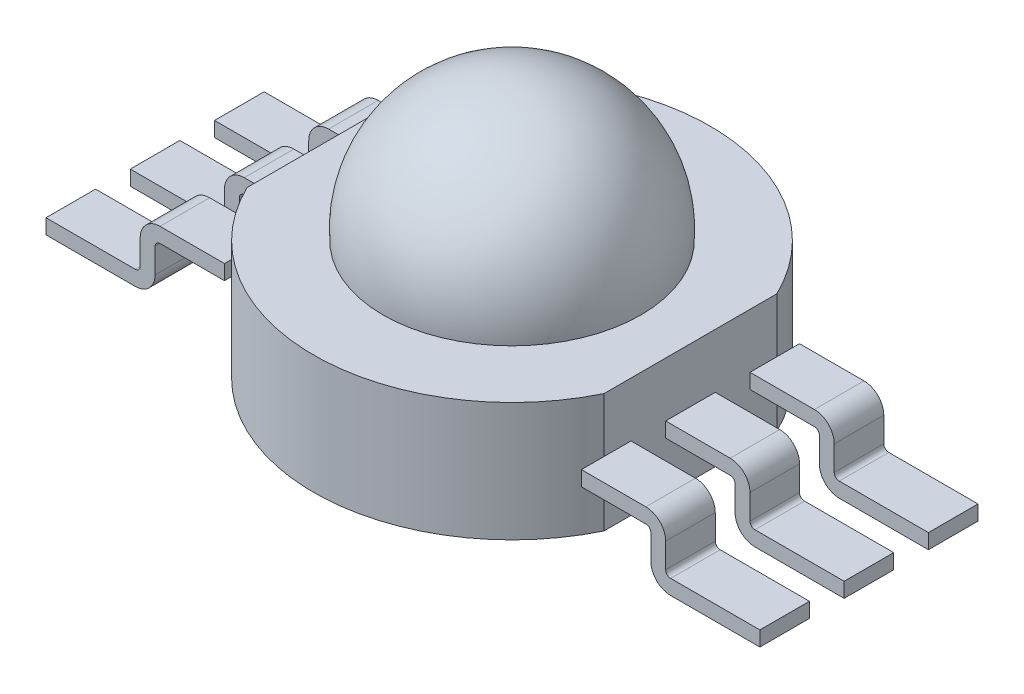
from build123d import *

# Parameters (mm, degrees)
LED_BASE_BOSS_EXTRUDE1_DEPTH       = 2.4
PIN_RIGHT_BOSS_EXTRUDE2_DEPTH      = 2.2
PIN_RIGHT_SPACE_CUT_EXTRUDE1_REACH = 11.113
SKETCH5_W                          = 3.6
SKETCH5_H                          = 0.7
SKETCH6_R                          = 2.95
HEATSINK_BOSS_EXTRUDE3_DEPTH       = 0.1


with BuildPart() as part:
    # Sketch1 → LED Base Boss-Extrude1 (new body)
    with BuildSketch(Plane(origin=(0, 0, 0), x_dir=(1, 0, 0), z_dir=(0, 1, 0))):
        with BuildLine():
            Line((-3.6, 1.743559577), (-3.6, -1.743559577))
            ThreePointArc((-3.6, -1.743559577), (0, -4), (3.6, -1.743559577))
            Line((3.6, -1.743559577), (3.6, 1.743559577))
            ThreePointArc((3.6, 1.743559577), (0, 4), (-3.6, 1.743559577))
        make_face()
    extrude(amount=LED_BASE_BOSS_EXTRUDE1_DEPTH)

    # Sketch3 → LED Lens Revolve2 (revolve)
    with BuildSketch(Plane.XY):
        with BuildLine():
            Line((2.6, 2.4), (0, 2.4))
            Line((0, 2.4), (0, 5.2))
            ThreePointArc((0, 5.2), (1.910497317, 4.366890366), (2.6, 2.4))
        make_face()
    revolve(axis=Axis((0, 5.2, 0), (0, -1, 0)))

    # Sketch4 → Pin Right Boss-Extrude2 (add, symmetric)
    with BuildSketch(Plane.XY):
        with BuildLine():
            Line((3.6, 1.3), (4.9, 1.3))
            ThreePointArc((4.9, 1.3), (5.182842712, 1.182842712), (5.3, 0.9))
            Line((5.3, 0.9), (5.3, 0.4))
            ThreePointArc((5.3, 0.4), (5.329289322, 0.329289322), (5.4, 0.3))
            Line((5.4, 0.3), (7.2, 0.3))
            Line((7.2, 0.3), (7.2, 0))
            Line((7.2, 0), (5.4, 0))
            ThreePointArc((5.4, 0), (5.117157288, 0.117157288), (5, 0.4))
            Line((5, 0.4), (5, 0.9))
            ThreePointArc((5, 0.9), (4.970710678, 0.970710678), (4.9, 1))
            Line((4.9, 1), (3.6, 1))
            Line((3.6, 1), (3.6, 1.3))
        make_face()
    pin_right_boss_extrude2 = extrude(amount=PIN_RIGHT_BOSS_EXTRUDE2_DEPTH, both=True)

    # Pin Right Space Cut-Extrude1: up to this face of the body (flat: up to its plane)
    pin_right_space_cut_extrude1_end = Plane(part.part.faces().sort_by_distance((6.3, 0, 0))[0])
    # Sketch5 → Pin Right Space Cut-Extrude1 (cut, up to the picked face)
    with BuildSketch(Plane(origin=(0, 1.3, 0), x_dir=(1, 0, 0), z_dir=(0, 1, 0)), mode=Mode.PRIVATE) as pin_right_space_cut_extrude1_sk1:
        with Locations((5.4, 0.85)):
            Rectangle(SKETCH5_W, SKETCH5_H)
    pin_right_space_cut_extrude1_tool1 = split(extrude(pin_right_space_cut_extrude1_sk1.sketch, amount=-PIN_RIGHT_SPACE_CUT_EXTRUDE1_REACH, mode=Mode.PRIVATE), bisect_by=pin_right_space_cut_extrude1_end, keep=Keep.BOTH, mode=Mode.PRIVATE)
    # Sketch5 → Pin Right Space Cut-Extrude1 (cut, up to the picked face)
    with BuildSketch(Plane(origin=(0, 1.3, 0), x_dir=(1, 0, 0), z_dir=(0, 1, 0)), mode=Mode.PRIVATE) as pin_right_space_cut_extrude1_sk2:
        with Locations((5.4, -0.85)):
            Rectangle(SKETCH5_W, SKETCH5_H)
    pin_right_space_cut_extrude1_tool2 = split(extrude(pin_right_space_cut_extrude1_sk2.sketch, amount=-PIN_RIGHT_SPACE_CUT_EXTRUDE1_REACH, mode=Mode.PRIVATE), bisect_by=pin_right_space_cut_extrude1_end, keep=Keep.BOTH, mode=Mode.PRIVATE)
    pin_right_space_cut_extrude1_1 = pin_right_space_cut_extrude1_tool1.solids().sort_by(Axis((5.4, 1.3, -0.85), (0, -1, 0)))[0]
    add(pin_right_space_cut_extrude1_1, mode=Mode.SUBTRACT)
    pin_right_space_cut_extrude1_2 = pin_right_space_cut_extrude1_tool2.solids().sort_by(Axis((5.4, 1.3, 0.85), (0, -1, 0)))[0]
    add(pin_right_space_cut_extrude1_2, mode=Mode.SUBTRACT)
    pin_right_space_cut_extrude1 = pin_right_space_cut_extrude1_1 + pin_right_space_cut_extrude1_2  # Pin Right Space Cut-Extrude1 as one shape, for the pattern or mirror that repeats it

    # Pin Left Mirror1: Pin Right Boss-Extrude2, Pin Right Space Cut-Extrude1 across plane
    add(pin_right_boss_extrude2.mirror(Plane(origin=(0, 0, 0), x_dir=(0, 0, 1), z_dir=(1, 0, 0))))
    add(pin_right_space_cut_extrude1.mirror(Plane(origin=(0, 0, 0), x_dir=(0, 0, 1), z_dir=(1, 0, 0))), mode=Mode.SUBTRACT)

    # Sketch6 → Heatsink Boss-Extrude3 (add)
    with BuildSketch(Plane.XZ):
        with Locations(Location((0, 0, 0), (0, 0, 90))):
            Circle(SKETCH6_R)
    extrude(amount=HEATSINK_BOSS_EXTRUDE3_DEPTH)


solid = part.part
